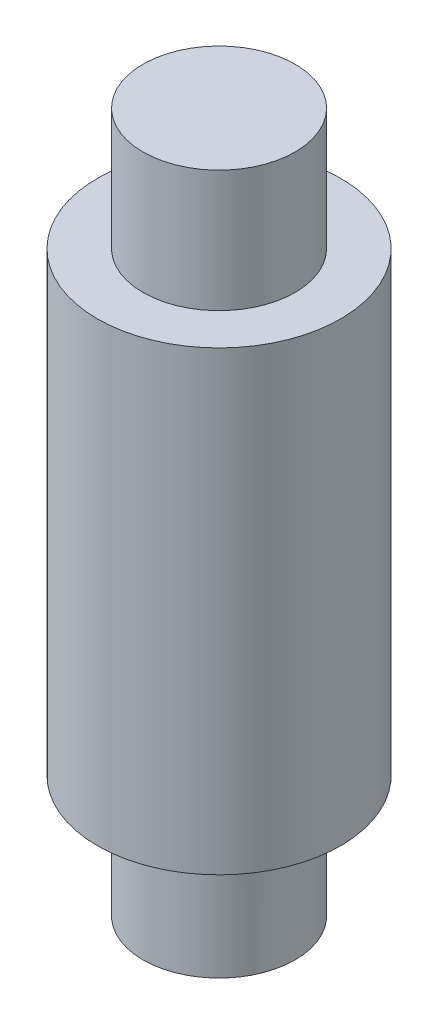
from build123d import *

# Parameters (mm, degrees)
SKETCH_1_R      = 4
EXTRUDE_1_DEPTH = 15
SKETCH_2_R      = 2.5
EXTRUDE_2_DEPTH = 4
EXTRUDE_START   = 4
SKETCH_3_R      = 2.5
EXTRUDE_3_DEPTH = 4


with BuildPart() as part:
    # 草图1 → 凸台-拉伸1 (new body)
    with BuildSketch(Plane(origin=(0, 0, 0), x_dir=(1, 0, 0), z_dir=(0, 1, 0))):
        with Locations(Location((0, 0, 0), (0, 0, 270))):
            Circle(SKETCH_1_R)
    extrude(amount=EXTRUDE_1_DEPTH)

    # 草图2 → 凸台-拉伸2 (add)
    with BuildSketch(Plane(origin=(0, 15, 0), x_dir=(1, 0, 0), z_dir=(0, 1, 0))):
        with Locations(Location((0, 0, 0), (0, 0, 270))):
            Circle(SKETCH_2_R)
    extrude(amount=EXTRUDE_2_DEPTH)

    # 草图3 → 凸台-拉伸3 (add)
    with BuildSketch(Plane(origin=(0, 0, 0), x_dir=(-1, 0, 0), z_dir=(0, -1, 0)).offset(EXTRUDE_START)):
        with Locations(Location((0, 0, 0), (0, 0, 270))):
            Circle(SKETCH_3_R)
    extrude(amount=-EXTRUDE_3_DEPTH)


solid = part.part
